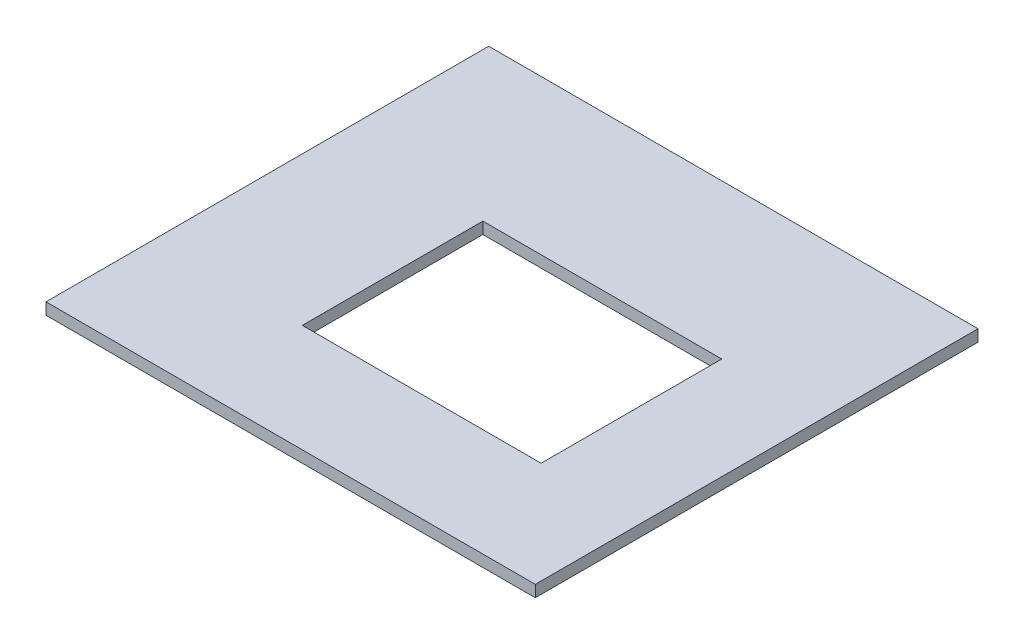
from build123d import *

# Parameters (mm, degrees)
SKETCH_1_W         = 42
SKETCH_1_H         = 38
TOP_DEPTH          = 1
DHT22_WINDOW_REACH = 30.337
SKETCH_2_W         = 20.5
SKETCH_2_H         = 15.5


with BuildPart() as part:
    # 스케치1 → Top (new body)
    with BuildSketch(Plane(origin=(0, 0, 0), x_dir=(1, 0, 0), z_dir=(0, 1, 0))):
        Rectangle(SKETCH_1_W, SKETCH_1_H)
    extrude(amount=TOP_DEPTH)

    # 스케치2 → DHT22_window (cut, up to next)
    with BuildSketch(Plane(origin=(0, 1, 0), x_dir=(1, 0, 0), z_dir=(0, 1, 0)), mode=Mode.PRIVATE) as dht22_window_sk1:
        with Locations((2, -2)):
            Rectangle(SKETCH_2_W, SKETCH_2_H)
    dht22_window_tool1 = extrude(dht22_window_sk1.sketch, amount=-DHT22_WINDOW_REACH, mode=Mode.PRIVATE) & part.part
    add(dht22_window_tool1.solids().sort_by_distance((2, 1, 2))[0], mode=Mode.SUBTRACT)


solid = part.part
